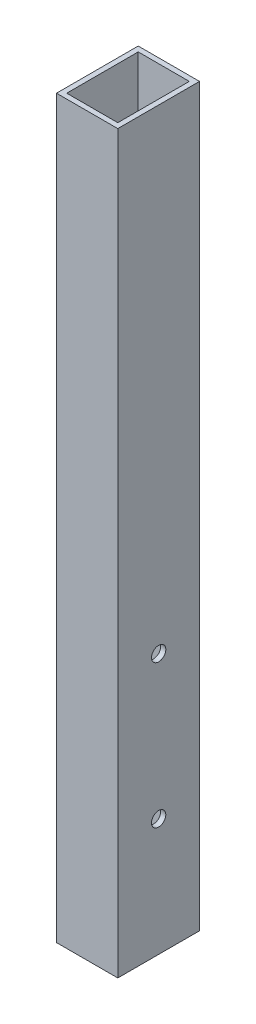
from build123d import *

# Parameters (mm, degrees)
SKETCH1_W           = 76.2
SKETCH1_H           = 101.6
BOSS_EXTRUDE1_DEPTH = 914.4
SKETCH2_W           = 63.5
SKETCH2_H           = 88.9
CUT_EXTRUDE1_DEPTH  = 917.602209249
SKETCH3_R           = 8.89
CUT_EXTRUDE2_DEPTH  = 919.974667768


with BuildPart() as part:
    # Sketch1 → Boss-Extrude1 (new body)
    with BuildSketch(Plane(origin=(0, 0, 0), x_dir=(1, 0, 0), z_dir=(0, 1, 0))):
        Rectangle(SKETCH1_W, SKETCH1_H)
    extrude(amount=BOSS_EXTRUDE1_DEPTH)

    # Sketch2 → Cut-Extrude1 (cut, through all)
    with BuildSketch(Plane(origin=(0, 914.4, 0), x_dir=(1, 0, 0), z_dir=(0, 1, 0))):
        Rectangle(SKETCH2_W, SKETCH2_H)
    extrude(amount=-CUT_EXTRUDE1_DEPTH, mode=Mode.SUBTRACT)

    # Sketch3 → Cut-Extrude2 (cut, through all)
    with BuildSketch(Plane.ZY.offset(38.1)):
        with Locations((0, 146.05)):
            Circle(SKETCH3_R)
        with Locations((0, 323.85)):
            Circle(SKETCH3_R)
    extrude(amount=-CUT_EXTRUDE2_DEPTH, mode=Mode.SUBTRACT)


solid = part.part
